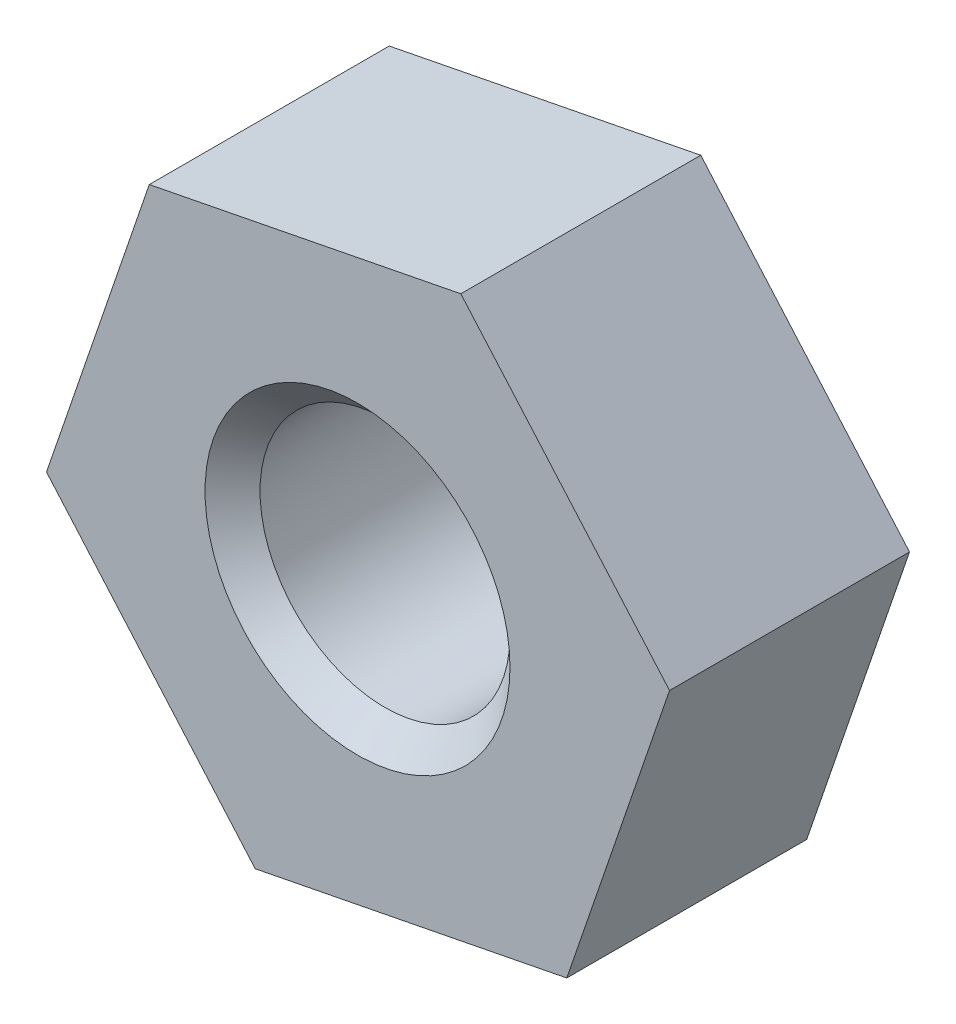
from build123d import *

# Parameters (mm, degrees)
BOSS_EXTRUDE1_DEPTH         = 2.4
M3_TAPPED_HOLE3_D           = 2.5
M3_TAPPED_HOLE3_CSINK_D     = 3.05
M3_TAPPED_HOLE3_CSINK_ANGLE = 90


with BuildPart() as part:
    # Sketch1 → Boss-Extrude1 (new body)
    with BuildSketch(Plane.XY):
        Polygon((2.087817816, -2.39256141), (3.115927869, 0.611822562), (1.028110053, 3.004383972), (-2.087817816, 2.39256141), (-3.115927869, -0.611822562), (-1.028110053, -3.004383972), align=None)
    extrude(amount=BOSS_EXTRUDE1_DEPTH)

    # M3 Tapped Hole3 (through all)
    with Locations(Plane(origin=(-0.005030104, 0.016129016, 2.4), x_dir=(1, 0, 0), z_dir=(0, 0, 1))):
        with Locations((0, 0)):
            CounterSinkHole(M3_TAPPED_HOLE3_D / 2, M3_TAPPED_HOLE3_CSINK_D / 2, counter_sink_angle=M3_TAPPED_HOLE3_CSINK_ANGLE)


solid = part.part
